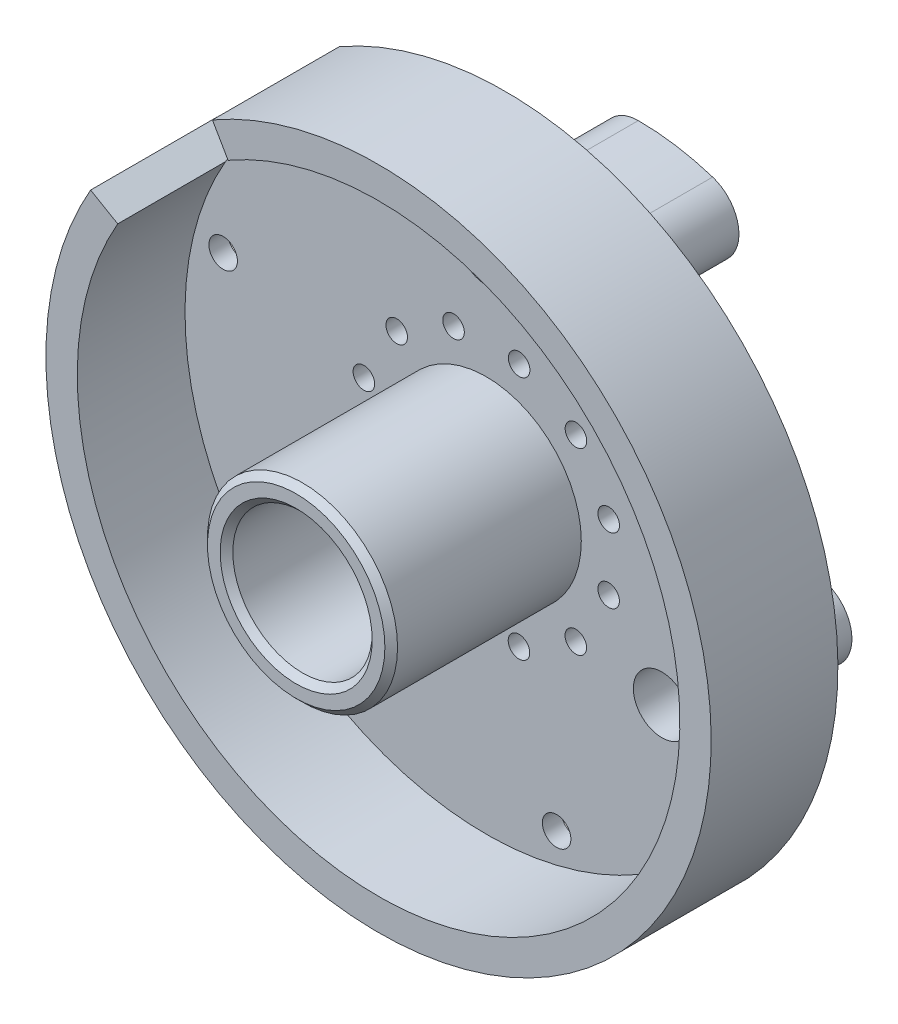
from build123d import *

# Parameters (mm, degrees)
SKETCH_1_R                   = 41
EXTRUDE_1_DEPTH              = 6
SKETCH_2_R                   = 15
EXTRUDE_2_DEPTH              = 30
SKETCH_3_R                   = 9.275
CUT_EXTRUDE_2_DEPTH          = 7
SKETCH_6_R                   = 11
CUT_EXTRUDE_3_DEPTH          = 65.830548355
CHAMFER_1_SIZE               = 0.5
SKETCH_7_R                   = 6
EXTRUDE_3_DEPTH              = 18
PATTERN_CIRCULAR_1_COUNT     = 3
SKETCH_8_R                   = 4.5
CUT_EXTRUDE_4_DEPTH          = 17
PATTERN_CIRCULAR_2_COUNT     = 3
SKETCH_9_R                   = 2.25
CUT_EXTRUDE_5_DEPTH          = 75.639131828
PATTERN_CIRCULAR_3_COUNT     = 3
F_5_0MM_1_D                  = 5
F_5_0MM_1_CSINK_D            = 5.05
F_5_0MM_1_CSINK_ANGLE        = 90
F_5_0MM_2_D                  = 5
F_5_0MM_2_CSINK_D            = 5.05
F_5_0MM_2_CSINK_ANGLE        = 90
EXTRUDE_5_DEPTH              = 18
F_5_0MM_3_AT_2_COUNT         = 2
F_5_0MM_3_AT_2_PITCH         = 62.596471695
EXTRUDE_6_DEPTH              = 17
EXTRUDE_6_DEPTH_BACK         = 3
SKETCH_20_R                  = 52.5
SKETCH_20_R_2                = 47.55
CUT_EXTRUDE_6_DEPTH          = 85.814503477
EXTRUDE_START                = -3
SKETCH_25_R                  = 47.55
SKETCH_25_R_2                = 41
EXTRUDE_7_DEPTH              = 3
HOLE_WIZARD_M3_1_D           = 3.4
HOLE_WIZARD_M3_1_CBORE_D     = 6
HOLE_WIZARD_M3_1_CBORE_DEPTH = 3.4
PATTERN_CIRCULAR_4_COUNT     = 12
CHAMFER_2_SIZE               = 1
SKETCH_30_R                  = 2.25
CUT_EXTRUDE_9_DEPTH          = 81.07808689
PATTERN_CIRCULAR_16_COUNT    = 6
SKETCH_31_R                  = 4
CUT_EXTRUDE_10_DEPTH         = 3
PATTERN_CIRCULAR_17_COUNT    = 6


with BuildPart() as part:
    # 草图1 → 凸台-拉伸1 (new body)
    with BuildSketch(Plane.XY):
        Circle(SKETCH_1_R)
    extrude(amount=EXTRUDE_1_DEPTH)

    # 草图2 → 凸台-拉伸2 (add)
    with BuildSketch(Plane.XY.offset(6)):
        Circle(SKETCH_2_R)
    extrude(amount=EXTRUDE_2_DEPTH)

    # 草图3 → 切除-拉伸2 (cut)
    with BuildSketch(Plane(origin=(0, 0, 0), x_dir=(-1, 0, 0), z_dir=(0, 0, -1))):
        Circle(SKETCH_3_R)
    extrude(amount=-CUT_EXTRUDE_2_DEPTH, mode=Mode.SUBTRACT)

    # 草图6 → 切除-拉伸3 (cut, through all)
    with BuildSketch(Plane(origin=(0, 0, 7), x_dir=(-1, 0, 0), z_dir=(0, 0, -1))):
        Circle(SKETCH_6_R)
    extrude(amount=-CUT_EXTRUDE_3_DEPTH, mode=Mode.SUBTRACT)

    # 倒角1
    chamfer_1_edges = [part.edges().sort_by_distance(p)[0] for p in [
        (9.275, 0, 0),
    ]]
    chamfer(chamfer_1_edges, length=CHAMFER_1_SIZE)

    # 草图7 → 凸台-拉伸3 (add)
    with BuildSketch(Plane(origin=(0, 0, 0), x_dir=(-1, 0, 0), z_dir=(0, 0, -1))):
        with Locations(Location((0, 32, 0), (0, 0, 180))):
            Circle(SKETCH_7_R)
    extrude_3 = extrude(amount=EXTRUDE_3_DEPTH)

    # 阵列(圆周)1: 凸台-拉伸3 ×3 about axis
    pattern_circular_1_axis = Axis((0, 0, 0), (0, 0, 1))
    for i in range(1, PATTERN_CIRCULAR_1_COUNT):
        add(extrude_3.rotate(pattern_circular_1_axis, i * 360 / PATTERN_CIRCULAR_1_COUNT))

    # 草图8 → 切除-拉伸4 (cut)
    with BuildSketch(Plane.XY.offset(6)):
        with Locations((0, 32)):
            Circle(SKETCH_8_R)
    cut_extrude_4 = extrude(amount=-CUT_EXTRUDE_4_DEPTH, mode=Mode.SUBTRACT)

    # 阵列(圆周)2: 切除-拉伸4 ×3 about axis
    pattern_circular_2_axis = Axis((0, 0, 0), (0, 0, 1))
    for i in range(1, PATTERN_CIRCULAR_2_COUNT):
        add(cut_extrude_4.rotate(pattern_circular_2_axis, i * 360 / PATTERN_CIRCULAR_2_COUNT), mode=Mode.SUBTRACT)

    # 草图9 → 切除-拉伸5 (cut, through all)
    with BuildSketch(Plane.XY.offset(-11)):
        with Locations((0, 32)):
            Circle(SKETCH_9_R)
    cut_extrude_5 = extrude(amount=-CUT_EXTRUDE_5_DEPTH, mode=Mode.SUBTRACT)

    # 阵列(圆周)3: 切除-拉伸5 ×3 about axis
    pattern_circular_3_axis = Axis((0, 0, 0), (0, 0, 1))
    for i in range(1, PATTERN_CIRCULAR_3_COUNT):
        add(cut_extrude_5.rotate(pattern_circular_3_axis, i * 360 / PATTERN_CIRCULAR_3_COUNT), mode=Mode.SUBTRACT)

    # Ø5.0mm 暗销孔1 (through all)
    with Locations(Plane.XY.offset(6)):
        with Locations((-21.421060687, -23.772634646), (-27.712813081, -15.99999984)):
            CounterSinkHole(F_5_0MM_1_D / 2, F_5_0MM_1_CSINK_D / 2, counter_sink_angle=F_5_0MM_1_CSINK_ANGLE)

    # Ø5.0mm 暗销孔2 (through all)
    with Locations(Plane.XY.offset(6)):
        with Locations((9.877175378, 30.437499903)):
            CounterSinkHole(F_5_0MM_2_D / 2, F_5_0MM_2_CSINK_D / 2, counter_sink_angle=F_5_0MM_2_CSINK_ANGLE)

    # 草图18 → 凸台-拉伸5 (add)
    with BuildSketch(Plane(origin=(0, 0, 0), x_dir=(-1, 0, 0), z_dir=(0, 0, -1))):
        with BuildLine():
            ThreePointArc((-11.729145803, 36.144531262), (-15.584206737, 28.585529478), (-8.025205013, 24.730468729))
            ThreePointArc((-8.025205013, 24.730468729), (-4.062500003, 25.680656004), (0, 26))
            ThreePointArc((0, 26), (-6, 32), (0, 38))
            ThreePointArc((0, 38), (-5.937500012, 37.533266511), (-11.729145803, 36.144531262))
        make_face()
        with BuildLine():
            ThreePointArc((17.404611815, -19.315265657), (16.963691699, -27.789083518), (25.437509581, -28.230003658))
            ThreePointArc((25.437509581, -28.230003658), (29.536012358, -23.90865898), (32.908965344, -19))
            ThreePointArc((32.908965344, -19), (24.712812921, -21.196152423), (22.516660498, -13))
            ThreePointArc((22.516660498, -13), (20.208850557, -16.358556141), (17.404611815, -19.315265657))
        make_face()
    extrude(amount=EXTRUDE_5_DEPTH)

    # 草图19 → Ø5.0mm 暗销孔3 (revolve, cut)
    with BuildSketch(Plane(origin=(9.877175378, 30.437499903, 0), x_dir=(0, -1, 0), z_dir=(1, 0, 0))):
        Polygon((0, 0), (0, 18), (2.5, 18), (2.5, 0.025), (2.525, 0), align=None)
    f_5_0mm_3 = revolve(axis=Axis((9.877175378, 30.437499903, 6.35), (0, 0, -1)), mode=Mode.SUBTRACT)

    # Ø5.0mm 暗销孔3 at 2: Ø5.0mm 暗销孔3 ×2
    with Locations(*[Vector(-0.5000000034830118, -0.8660254017735209, 0) * (i * F_5_0MM_3_AT_2_PITCH) for i in range(1, F_5_0MM_3_AT_2_COUNT)]):
        add(f_5_0mm_3, mode=Mode.SUBTRACT)



with BuildPart() as body_2:
    # 草图20 → 凸台-拉伸6 (new, two sides: drawn at the far end of the back side and taken through both)
    with BuildSketch(Plane.XY.offset(6).offset(-EXTRUDE_6_DEPTH_BACK)):
        Circle(SKETCH_20_R)
        Circle(SKETCH_20_R_2, mode=Mode.SUBTRACT)
    extrude(amount=EXTRUDE_6_DEPTH + EXTRUDE_6_DEPTH_BACK)

    # 草图23 → 切除-拉伸6 (cut, through all)
    with BuildSketch(Plane.XY.offset(23)):
        with BuildLine():
            Line((-41.163149036, 23.803311985), (-45.448271806, 26.281259289))
            ThreePointArc((-45.448271806, 26.281259289), (-37.097569065, 37.148625405), (-26.218728298, 45.484374091))
            Line((-26.218728298, 45.484374091), (-23.746676773, 41.195847391))
            ThreePointArc((-23.746676773, 41.195847391), (-33.599798267, 33.646040724), (-41.163149036, 23.803311985))
        make_face()
    extrude(amount=-CUT_EXTRUDE_6_DEPTH, mode=Mode.SUBTRACT)


with BuildPart() as part_1:
    add(part.part)

    add(body_2.part)  # 凸台-拉伸7 merges body 2
    # 草图25 → 凸台-拉伸7 (add)
    with BuildSketch(Plane.XY.offset(6).offset(EXTRUDE_START)):
        Circle(SKETCH_25_R)
        Circle(SKETCH_25_R_2, mode=Mode.SUBTRACT)
    extrude(amount=EXTRUDE_7_DEPTH)

    # M3 六角圆柱头螺钉的柱形沉头孔1 (through all)
    with Locations(Plane(origin=(0, 0, 0), x_dir=(-1, 0, 0), z_dir=(0, 0, -1))):
        with Locations((5.189664299, -19.314952355)):
            hole_wizard_m3_1 = CounterBoreHole(HOLE_WIZARD_M3_1_D / 2, HOLE_WIZARD_M3_1_CBORE_D / 2, HOLE_WIZARD_M3_1_CBORE_DEPTH)

    # 阵列(圆周)4: M3 六角圆柱头螺钉的柱形沉头孔1 ×12 about axis
    pattern_circular_4_axis = Axis((0, 0, 0), (0, 0, 1))
    for i in range(1, PATTERN_CIRCULAR_4_COUNT):
        add(hole_wizard_m3_1.rotate(pattern_circular_4_axis, i * 360 / PATTERN_CIRCULAR_4_COUNT), mode=Mode.SUBTRACT)

    # 倒角2
    chamfer_2_edges = [part_1.edges().sort_by_distance(p)[0] for p in [
        (11, 0, 36),
        (-15, 0, 36),
    ]]
    chamfer(chamfer_2_edges, length=CHAMFER_2_SIZE)

    # 草图30 → 切除-拉伸9 (cut, through all)
    with BuildSketch(Plane.XY.offset(6)):
        with Locations((-41.527147563, 11.157778242)):
            Circle(SKETCH_30_R)
    cut_extrude_9 = extrude(amount=-CUT_EXTRUDE_9_DEPTH, mode=Mode.SUBTRACT)

    # 阵列(圆周)16: 切除-拉伸9 ×6 about axis
    pattern_circular_16_axis = Axis((0, 0, 0), (0, 0, 1))
    for i in range(1, PATTERN_CIRCULAR_16_COUNT):
        add(cut_extrude_9.rotate(pattern_circular_16_axis, i * 360 / PATTERN_CIRCULAR_16_COUNT), mode=Mode.SUBTRACT)

    # 草图31 → 切除-拉伸10 (cut)
    with BuildSketch(Plane(origin=(0, 0, 3), x_dir=(-1, 0, 0), z_dir=(0, 0, -1))):
        with Locations((41.527147563, 11.157778242)):
            Circle(SKETCH_31_R)
    cut_extrude_10 = extrude(amount=CUT_EXTRUDE_10_DEPTH, mode=Mode.SUBTRACT)

    # 阵列(圆周)17: 切除-拉伸10 ×6 about axis
    pattern_circular_17_axis = Axis((0, 0, 0), (0, 0, 1))
    for i in range(1, PATTERN_CIRCULAR_17_COUNT):
        add(cut_extrude_10.rotate(pattern_circular_17_axis, i * 360 / PATTERN_CIRCULAR_17_COUNT), mode=Mode.SUBTRACT)


solid = part_1.part
